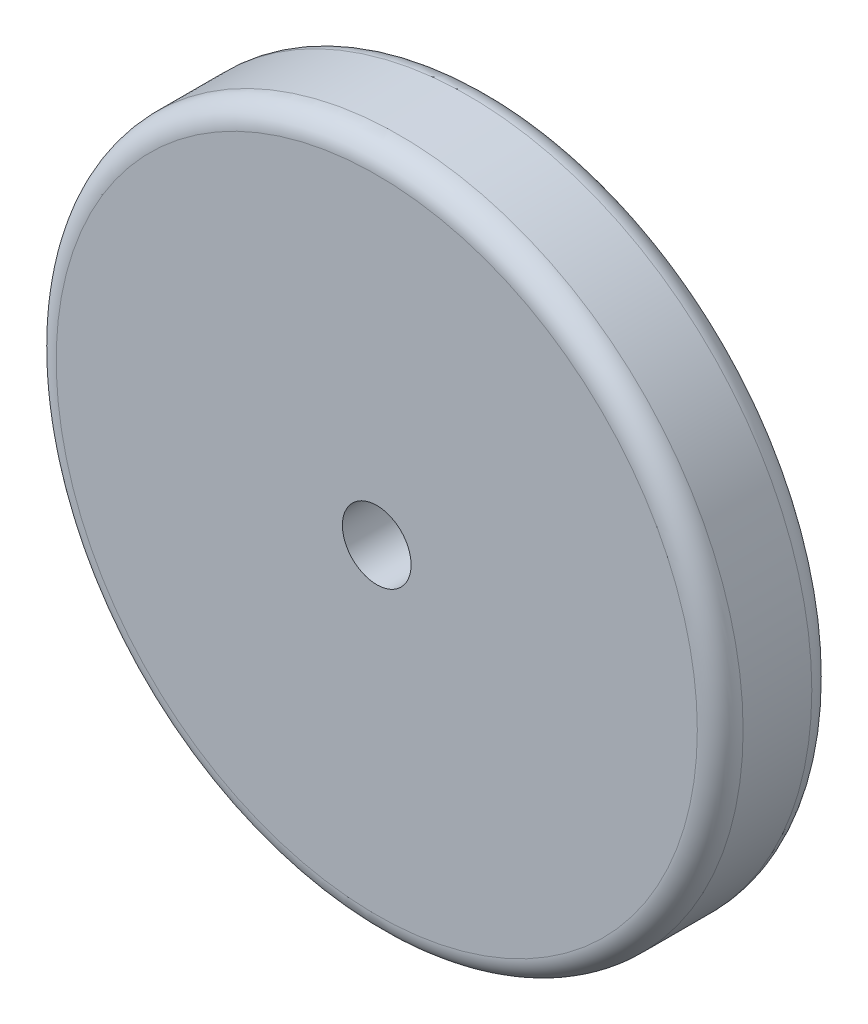
from build123d import *

# Parameters (mm, degrees)
CROQUIS1_R              = 7.5
SALIENTE_EXTRUIR1_DEPTH = 2.5
CROQUIS2_R              = 0.75
CORTAR_EXTRUIR1_DEPTH   = 2.5
REDONDEO1_R             = 0.5


with BuildPart() as part:
    # Croquis1 → Saliente-Extruir1 (new body)
    with BuildSketch(Plane.XY):
        Circle(CROQUIS1_R)
    extrude(amount=SALIENTE_EXTRUIR1_DEPTH)

    # Croquis2 → Cortar-Extruir1 (cut)
    with BuildSketch(Plane(origin=(0, 0, 0), x_dir=(-1, 0, 0), z_dir=(0, 0, -1))):
        Circle(CROQUIS2_R)
    extrude(amount=-CORTAR_EXTRUIR1_DEPTH, mode=Mode.SUBTRACT)

    # Redondeo1
    redondeo1_edges = [part.edges().sort_by_distance(p)[0] for p in [
        (-7.5, 0, 0),
        (-7.5, 0, 2.5),
    ]]
    fillet(redondeo1_edges, radius=REDONDEO1_R)


solid = part.part
